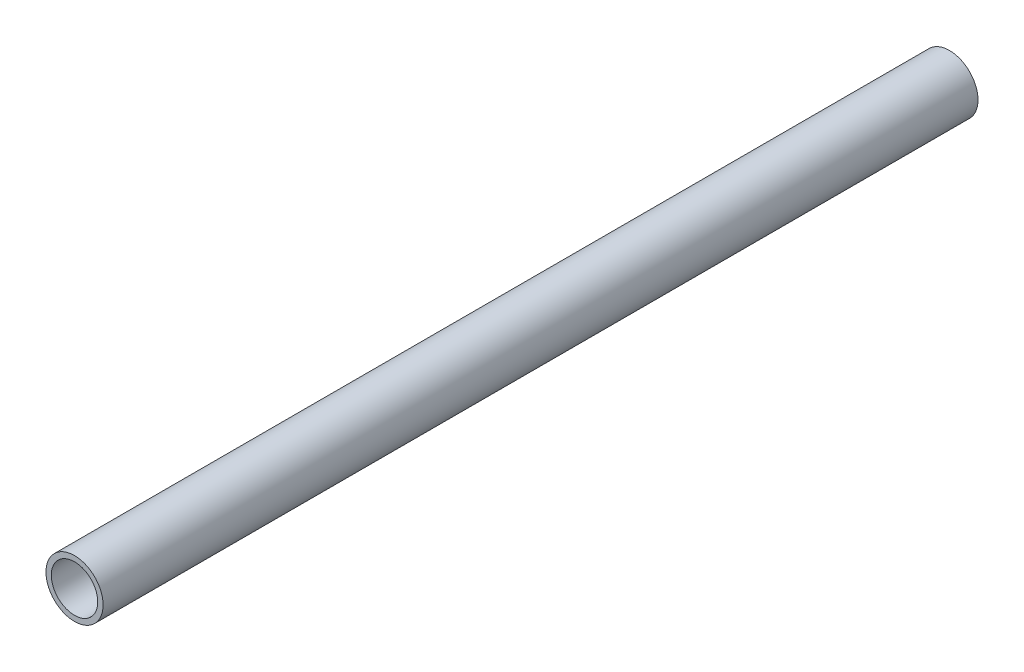
from build123d import *

# Parameters (mm, degrees)
CROQUIS1_R     = 16
EXTRUIR1_DEPTH = 245
VACIADO1_T     = -3


with BuildPart() as part:
    # Croquis1 → Extruir1 (new, symmetric)
    with BuildSketch(Plane.XY):
        Circle(CROQUIS1_R)
    extrude(amount=EXTRUIR1_DEPTH, both=True)

    # Vaciado1
    vaciado1_openings = [part.faces().sort_by_distance(p)[0] for p in [
        (0, 0, 245),
        (0, 0, -245),
    ]]
    offset(amount=VACIADO1_T, openings=vaciado1_openings, kind=Kind.INTERSECTION)


solid = part.part
